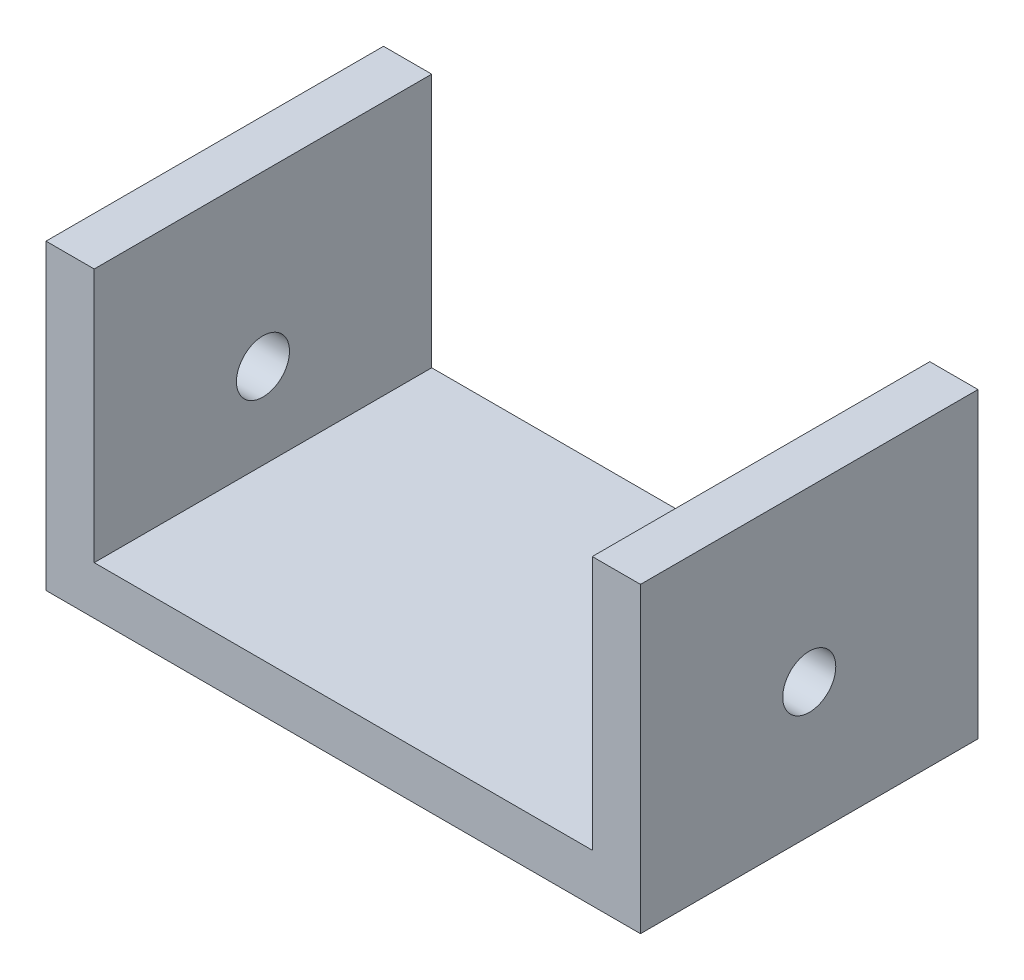
from build123d import *

# Parameters (mm, degrees)
SKETCH1_W           = 61.65
SKETCH1_H           = 31.375
BOSS_EXTRUDE1_DEPTH = 35
SKETCH2_W           = 51.65
SKETCH2_H           = 26.375
CUT_EXTRUDE1_DEPTH  = 50.206486171
SKETCH3_R           = 2.75
CUT_EXTRUDE2_DEPTH  = 73.607300984


with BuildPart() as part:
    # Sketch1 → Boss-Extrude1 (new body)
    with BuildSketch(Plane.XY):
        Rectangle(SKETCH1_W, SKETCH1_H)
    extrude(amount=BOSS_EXTRUDE1_DEPTH)

    # Sketch2 → Cut-Extrude1 (cut, through all)
    with BuildSketch(Plane(origin=(0, 0, 0), x_dir=(-1, 0, 0), z_dir=(0, 0, -1))):
        with Locations((0, 2.5)):
            Rectangle(SKETCH2_W, SKETCH2_H)
    extrude(amount=-CUT_EXTRUDE1_DEPTH, mode=Mode.SUBTRACT)

    # Sketch3 → Cut-Extrude2 (cut, through all)
    with BuildSketch(Plane(origin=(30.825, 0, 0), x_dir=(0, 0, -1), z_dir=(1, 0, 0))):
        with Locations((-17.5, -1.8125)):
            Circle(SKETCH3_R)
    extrude(amount=-CUT_EXTRUDE2_DEPTH, mode=Mode.SUBTRACT)


solid = part.part
